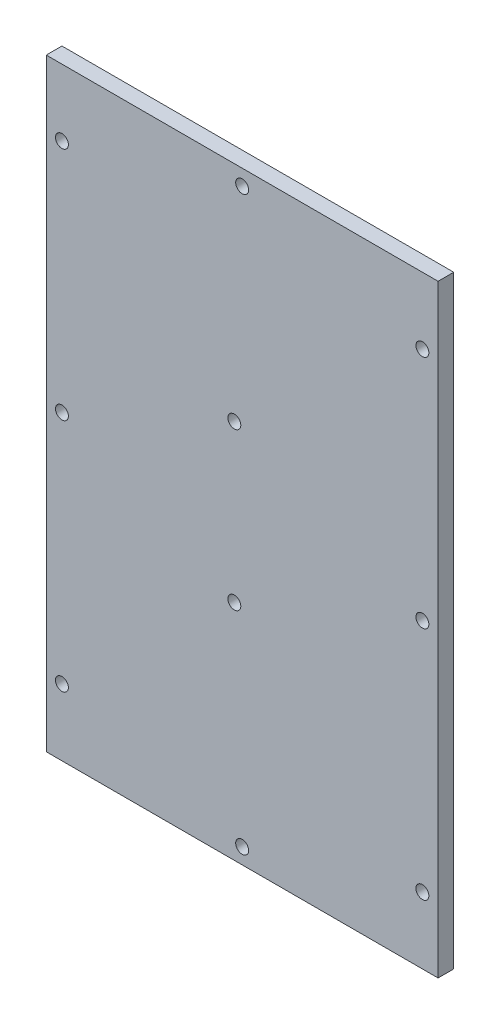
from build123d import *

# Parameters (mm, degrees)
SKETCH1_W                     = 154
SKETCH1_H                     = 100
BOSS_EXTRUDE1_DEPTH           = 4
SKETCH2_R                     = 1.65
CUT_EXTRUDE1_DEPTH            = 184.66273438
SKETCH3_R                     = 7.5
BOSS_EXTRUDE2_DEPTH           = 6
BOSS_EXTRUDE2_DRAFT           = 15
BOSS_EXTRUDE2_PROFILE_2_DEPTH = 6
BOSS_EXTRUDE2_PROFILE_2_DRAFT = 15
BOSS_EXTRUDE2_PROFILE_3_DEPTH = 6
BOSS_EXTRUDE2_PROFILE_3_DRAFT = 15
BOSS_EXTRUDE2_PROFILE_4_DEPTH = 6
BOSS_EXTRUDE2_PROFILE_4_DRAFT = 15
SKETCH4_R                     = 3
CUT_EXTRUDE2_DEPTH            = 1.5


with BuildPart() as part:
    # Sketch1 → Boss-Extrude1 (new body)
    with BuildSketch(Plane(origin=(0, 0, 0), x_dir=(0, 1, 0), z_dir=(0, 0, 1))):
        with Locations((77, 50)):
            Rectangle(SKETCH1_W, SKETCH1_H)
    extrude(amount=BOSS_EXTRUDE1_DEPTH)

    # Sketch2 → Cut-Extrude1 (cut, through all)
    with BuildSketch(Plane(origin=(0, 0, 0), x_dir=(1, 0, 0), z_dir=(0, 0, -1))):
        with Locations(Location((-4, -77, 0), (0, 0, 180))):
            Circle(SKETCH2_R)
        with Locations(Location((-4, -17, 0), (0, 0, 180))):
            Circle(SKETCH2_R)
        with Locations(Location((-4, -137, 0), (0, 0, 180))):
            Circle(SKETCH2_R)
        with Locations(Location((-96, -137, 0), (0, 0, 180))):
            Circle(SKETCH2_R)
        with Locations(Location((-96, -77, 0), (0, 0, 180))):
            Circle(SKETCH2_R)
        with Locations(Location((-96, -17, 0), (0, 0, 180))):
            Circle(SKETCH2_R)
        with Locations(Location((-52, -97, 0), (0, 0, 180))):
            Circle(SKETCH2_R)
        with Locations(Location((-52, -57, 0), (0, 0, 180))):
            Circle(SKETCH2_R)
        with Locations(Location((-50, -4, 0), (0, 0, 180))):
            Circle(SKETCH2_R)
        with Locations(Location((-50, -150, 0), (0, 0, 180))):
            Circle(SKETCH2_R)
    extrude(amount=-CUT_EXTRUDE1_DEPTH, mode=Mode.SUBTRACT)


with BuildPart() as boss_extrude2_tool:
    # Sketch3 → Boss-Extrude2 (with draft: the straight prism first)
    with BuildSketch(Plane(origin=(0, 0, 0), x_dir=(1, 0, 0), z_dir=(0, 0, -1))):
        with Locations((-85, -15)):
            Circle(SKETCH3_R)
    extrude(amount=BOSS_EXTRUDE2_DEPTH)
    # Boss-Extrude2: the draft: its side faces are tilted about the plane it starts from
    boss_extrude2_sides = [boss_extrude2_tool.faces().sort_by_distance(p)[0] for p in [
        (-92.5, 15, -3),
    ]]
    draft(boss_extrude2_sides, Plane(origin=(0, 0, 0), x_dir=(1, 0, 0), z_dir=(0, 0, -1)), BOSS_EXTRUDE2_DRAFT)


with BuildPart() as part_1:
    add(part.part)

    # Boss-Extrude2: add boss_extrude2_tool
    add(boss_extrude2_tool.part)


with BuildPart() as boss_extrude2_profile_2_tool:
    # Sketch3 → Boss-Extrude2 profile 2 (with draft: the straight prism first)
    with BuildSketch(Plane(origin=(0, 0, 0), x_dir=(1, 0, 0), z_dir=(0, 0, -1))):
        with Locations((-15, -15)):
            Circle(SKETCH3_R)
    extrude(amount=BOSS_EXTRUDE2_PROFILE_2_DEPTH)
    # Boss-Extrude2 profile 2: the draft: its side faces are tilted about the plane it starts from
    boss_extrude2_profile_2_sides = [boss_extrude2_profile_2_tool.faces().sort_by_distance(p)[0] for p in [
        (-22.5, 15, -3),
    ]]
    draft(boss_extrude2_profile_2_sides, Plane(origin=(0, 0, 0), x_dir=(1, 0, 0), z_dir=(0, 0, -1)), BOSS_EXTRUDE2_PROFILE_2_DRAFT)


with BuildPart() as part_2:
    add(part_1.part)

    # Boss-Extrude2 profile 2: add boss_extrude2_profile_2_tool
    add(boss_extrude2_profile_2_tool.part)


with BuildPart() as boss_extrude2_profile_3_tool:
    # Sketch3 → Boss-Extrude2 profile 3 (with draft: the straight prism first)
    with BuildSketch(Plane(origin=(0, 0, 0), x_dir=(1, 0, 0), z_dir=(0, 0, -1))):
        with Locations((-15, -139)):
            Circle(SKETCH3_R)
    extrude(amount=BOSS_EXTRUDE2_PROFILE_3_DEPTH)
    # Boss-Extrude2 profile 3: the draft: its side faces are tilted about the plane it starts from
    boss_extrude2_profile_3_sides = [boss_extrude2_profile_3_tool.faces().sort_by_distance(p)[0] for p in [
        (-22.5, 139, -3),
    ]]
    draft(boss_extrude2_profile_3_sides, Plane(origin=(0, 0, 0), x_dir=(1, 0, 0), z_dir=(0, 0, -1)), BOSS_EXTRUDE2_PROFILE_3_DRAFT)


with BuildPart() as part_3:
    add(part_2.part)

    # Boss-Extrude2 profile 3: add boss_extrude2_profile_3_tool
    add(boss_extrude2_profile_3_tool.part)


with BuildPart() as boss_extrude2_profile_4_tool:
    # Sketch3 → Boss-Extrude2 profile 4 (with draft: the straight prism first)
    with BuildSketch(Plane(origin=(0, 0, 0), x_dir=(1, 0, 0), z_dir=(0, 0, -1))):
        with Locations((-85, -139)):
            Circle(SKETCH3_R)
    extrude(amount=BOSS_EXTRUDE2_PROFILE_4_DEPTH)
    # Boss-Extrude2 profile 4: the draft: its side faces are tilted about the plane it starts from
    boss_extrude2_profile_4_sides = [boss_extrude2_profile_4_tool.faces().sort_by_distance(p)[0] for p in [
        (-92.5, 139, -3),
    ]]
    draft(boss_extrude2_profile_4_sides, Plane(origin=(0, 0, 0), x_dir=(1, 0, 0), z_dir=(0, 0, -1)), BOSS_EXTRUDE2_PROFILE_4_DRAFT)


with BuildPart() as part_4:
    add(part_3.part)

    # Boss-Extrude2 profile 4: add boss_extrude2_profile_4_tool
    add(boss_extrude2_profile_4_tool.part)

    # Sketch4 → Cut-Extrude2 (cut)
    with BuildSketch(Plane(origin=(0, 0, 0), x_dir=(1, 0, 0), z_dir=(0, 0, -1))):
        with Locations(Location((-96, -17, 0), (0, 0, 180))):
            Circle(SKETCH4_R)
        with Locations(Location((-4, -17, 0), (0, 0, 180))):
            Circle(SKETCH4_R)
        with Locations(Location((-4, -77, 0), (0, 0, 180))):
            Circle(SKETCH4_R)
        with Locations(Location((-96, -77, 0), (0, 0, 180))):
            Circle(SKETCH4_R)
        with Locations(Location((-96, -137, 0), (0, 0, 180))):
            Circle(SKETCH4_R)
        with Locations(Location((-4, -137, 0), (0, 0, 180))):
            Circle(SKETCH4_R)
        with Locations(Location((-52, -57, 0), (0, 0, 180))):
            Circle(SKETCH4_R)
        with Locations(Location((-52, -97, 0), (0, 0, 180))):
            Circle(SKETCH4_R)
        with Locations(Location((-50, -4, 0), (0, 0, 180))):
            Circle(SKETCH4_R)
        with Locations(Location((-50, -150, 0), (0, 0, 180))):
            Circle(SKETCH4_R)
    extrude(amount=-CUT_EXTRUDE2_DEPTH, mode=Mode.SUBTRACT)


solid = part_4.part
